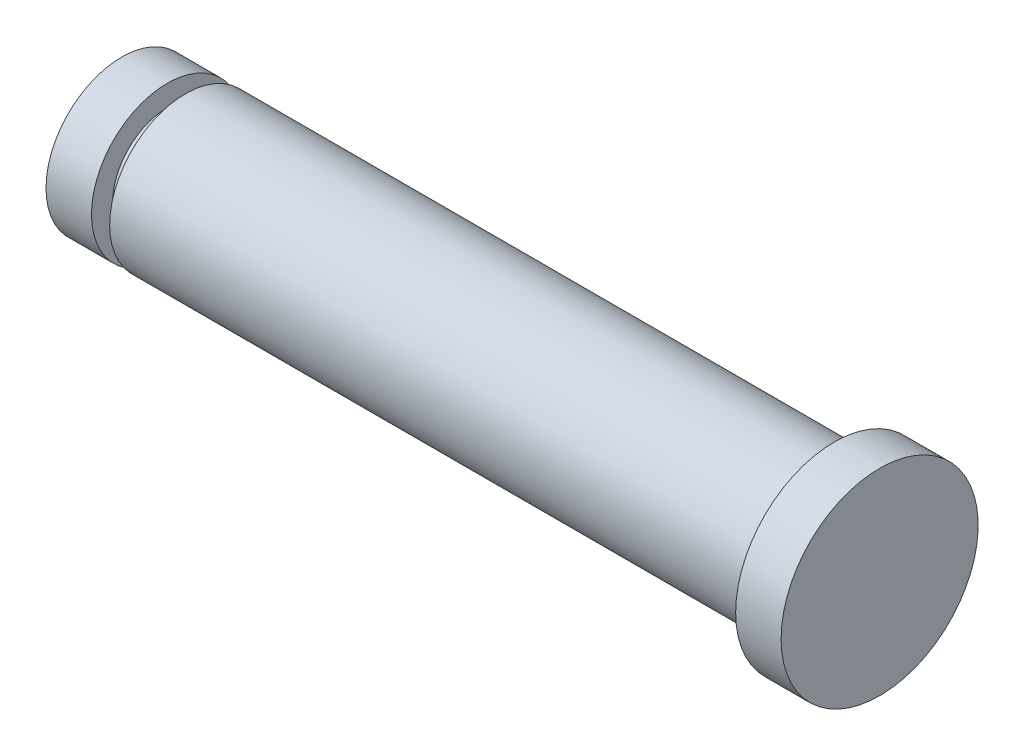
from build123d import *


with BuildPart() as part:
    # 草图1 → 旋转1 (revolve)
    with BuildSketch(Plane.XY, mode=Mode.PRIVATE) as revolve_1_sk:
        Polygon((0, 0), (250, 0), (250, 32.5), (235, 32.5), (235, 25), (21, 25), (21, 18), (15, 18), (15, 25), (0, 25), align=None)
    revolve(revolve_1_sk.sketch.rotate(Axis((0, 0, 0), (1, 0, 0)), 90), axis=Axis((0, 0, 0), (1, 0, 0)))


solid = part.part
